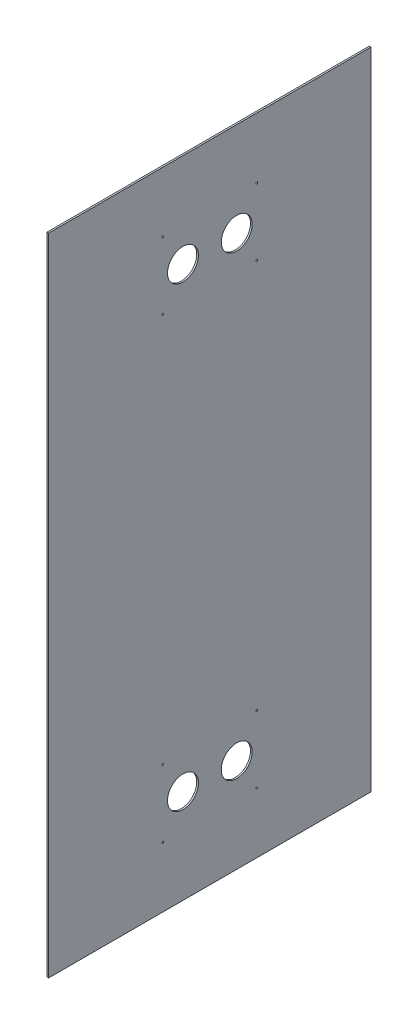
from build123d import *

# Parameters (mm, degrees)
SKETCH1_W           = 609.6
SKETCH1_H           = 1219.2
BOSS_EXTRUDE1_DEPTH = 3.175
SKETCH2_R           = 29.21
CUT_EXTRUDE1_DEPTH  = 682.560914831
SKETCH3_R           = 1.5875
CUT_EXTRUDE2_DEPTH  = 682.560914831


with BuildPart() as part:
    # Sketch1 → Boss-Extrude1 (new body)
    with BuildSketch(Plane(origin=(0, 0, 0), x_dir=(0, 0, -1), z_dir=(1, 0, 0))):
        Rectangle(SKETCH1_W, SKETCH1_H)
    extrude(amount=BOSS_EXTRUDE1_DEPTH)

    # Sketch2 → Cut-Extrude1 (cut, through all)
    with BuildSketch(Plane(origin=(3.175, 0, 0), x_dir=(0, 0, -1), z_dir=(1, 0, 0))):
        with Locations((-50.8, -431.8)):
            Circle(SKETCH2_R)
        with Locations((50.8, -431.8)):
            Circle(SKETCH2_R)
    cut_extrude1 = extrude(amount=-CUT_EXTRUDE1_DEPTH, mode=Mode.SUBTRACT)

    # Sketch3 → Cut-Extrude2 (cut, through all)
    with BuildSketch(Plane(origin=(3.175, 0, 0), x_dir=(0, 0, -1), z_dir=(1, 0, 0))):
        with Locations((-88.9, -368.3)):
            Circle(SKETCH3_R)
        with Locations((88.9, -368.3)):
            Circle(SKETCH3_R)
        with Locations((-88.9, -495.3)):
            Circle(SKETCH3_R)
        with Locations((88.9, -495.3)):
            Circle(SKETCH3_R)
    cut_extrude2 = extrude(amount=-CUT_EXTRUDE2_DEPTH, mode=Mode.SUBTRACT)

    # Mirror1: Cut-Extrude1, Cut-Extrude2 across plane
    add(cut_extrude1.mirror(Plane.ZX), mode=Mode.SUBTRACT)
    add(cut_extrude2.mirror(Plane.ZX), mode=Mode.SUBTRACT)


solid = part.part
